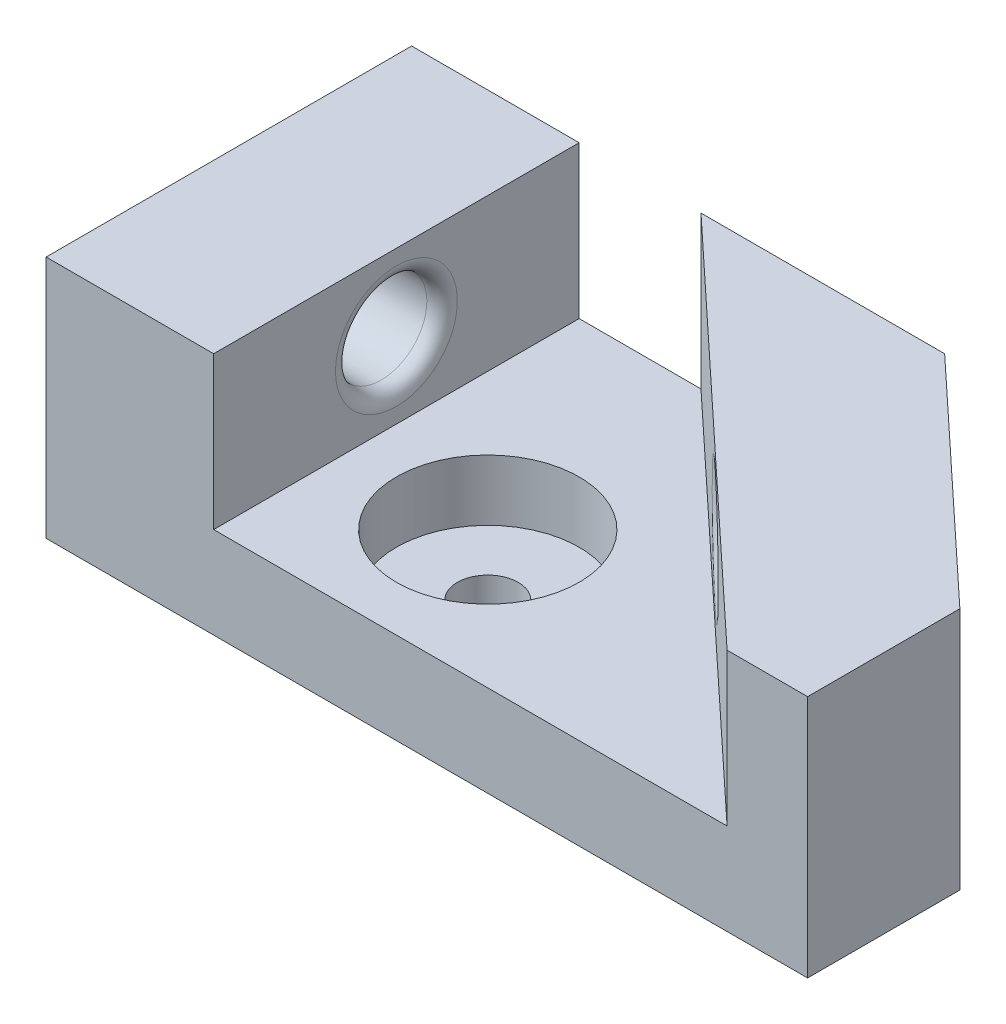
from build123d import *

# Parameters (mm, degrees)
SKETCH1_W           = 6350
SKETCH1_H           = 3048
BOSS_EXTRUDE1_DEPTH = 2032
CUT_EXTRUDE1_DEPTH  = 4754.238435433
CUT_EXTRUDE2_DEPTH  = 1270
SKETCH4_R           = 762
CUT_EXTRUDE3_DEPTH  = 508
SKETCH5_R           = 254
CUT_EXTRUDE4_DEPTH  = 4651.326399736
SKETCH6_R           = 381
CUT_EXTRUDE5_DEPTH  = 5980.063176597
FILLET1_R           = 127
SKETCH7_R           = 381
CUT_EXTRUDE6_DEPTH  = 4504.645028622
FILLET2_R           = 127


with BuildPart() as part:
    # Sketch1 → Boss-Extrude1 (new body)
    with BuildSketch(Plane(origin=(0, 0, 0), x_dir=(1, 0, 0), z_dir=(0, 1, 0))):
        with Locations((-197.875354108, -1138.322946176)):
            Rectangle(SKETCH1_W, SKETCH1_H)
    extrude(amount=BOSS_EXTRUDE1_DEPTH)

    # Sketch2 → Cut-Extrude1 (cut, through all)
    with BuildSketch(Plane(origin=(0, 2032, 0), x_dir=(1, 0, 0), z_dir=(0, 1, 0))):
        Polygon((1072.124645892, 385.677053824), (2977.124645892, -1392.322946176), (2977.124645892, 385.677053824), align=None)
    extrude(amount=-CUT_EXTRUDE1_DEPTH, mode=Mode.SUBTRACT)

    # Sketch3 → Cut-Extrude2 (cut)
    with BuildSketch(Plane(origin=(0, 2032, 0), x_dir=(1, 0, 0), z_dir=(0, 1, 0))):
        Polygon((-1975.875354108, 385.677053824), (-1975.875354108, -2662.322946176), (2305.838931607, -2662.322946176), (-959.875354108, 385.677053824), align=None)
    extrude(amount=-CUT_EXTRUDE2_DEPTH, mode=Mode.SUBTRACT)

    # Sketch4 → Cut-Extrude3 (cut)
    with BuildSketch(Plane(origin=(0, 762, 0), x_dir=(1, 0, 0), z_dir=(0, 1, 0))):
        with Locations(Location((-832.875354108, -1519.322946176, 0), (0, 0, 270))):
            Circle(SKETCH4_R)
    extrude(amount=-CUT_EXTRUDE3_DEPTH, mode=Mode.SUBTRACT)

    # Sketch5 → Cut-Extrude4 (cut, through all)
    with BuildSketch(Plane(origin=(0, 254, 0), x_dir=(1, 0, 0), z_dir=(0, 1, 0))):
        with Locations(Location((-832.875354108, -1519.322946176, 0), (0, 0, 270))):
            Circle(SKETCH5_R)
    extrude(amount=-CUT_EXTRUDE4_DEPTH, mode=Mode.SUBTRACT)

    # Sketch6 → Cut-Extrude5 (cut, through all)
    with BuildSketch(Plane(origin=(-1975.875354108, 0, 0), x_dir=(0, 0, -1), z_dir=(1, 0, 0))):
        with Locations((-1138.322946176, 1397)):
            Circle(SKETCH6_R)
    extrude(amount=-CUT_EXTRUDE5_DEPTH, mode=Mode.SUBTRACT)

    # Fillet1
    fillet1_edges = [part.edges().sort_by_distance(p)[0] for p in [
        (-3372.875354108, 1397, 1519.322946176),
        (-1975.875354108, 1397, 1519.322946176),
    ]]
    fillet(fillet1_edges, radius=FILLET1_R)

    # Sketch7 → Cut-Extrude6 (cut, through all)
    with BuildSketch(Plane(origin=(-254.497358912, 0, 272.675741692), x_dir=(0.7310552682428689, 0, 0.6823182503600114), z_dir=(-0.6823182503600114, 0, 0.7310552682428689))):
        with Locations((1470.247233198, 1397)):
            Circle(SKETCH7_R)
    extrude(amount=-CUT_EXTRUDE6_DEPTH, mode=Mode.SUBTRACT)

    # Fillet2
    fillet2_edges = [part.edges().sort_by_distance(p)[0] for p in [
        (1487.816821118, 1397, 2.30230972),
        (541.802569337, 1397, 1015.889008057),
    ]]
    fillet(fillet2_edges, radius=FILLET2_R)


solid = part.part
